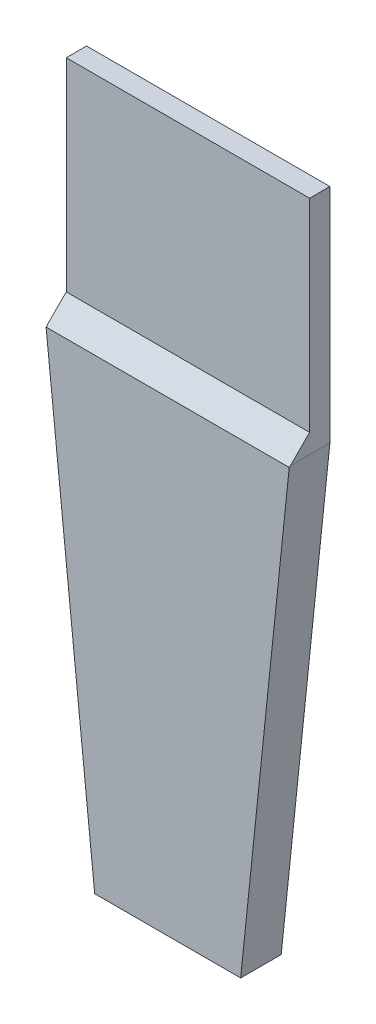
from build123d import *

# Parameters (mm, degrees)
EXTRUDE_1_DEPTH     = 1
EXTRUDE_2_DEPTH     = 6
CUT_EXTRUDE_1_DEPTH = 27.97425922


with BuildPart() as part:
    # 草图1 → 凸台-拉伸1 (new body)
    with BuildSketch(Plane.XY):
        Polygon((6, -3.227529416), (6, 7.720527774), (-6, 7.720527774), (-6, -3.227529416), (-3.598755957, -26.279472226), (3.598755957, -26.279472226), align=None)
    extrude(amount=EXTRUDE_1_DEPTH)

    # 草图2 → 凸台-拉伸2 (add, symmetric)
    with BuildSketch(Plane(origin=(0, 0, 0), x_dir=(0, 0, -1), z_dir=(1, 0, 0))):
        Polygon((-2, -26.279472226), (-1, -26.279472226), (-1, -2.279472226), (-2, -3.279472226), align=None)
    extrude(amount=EXTRUDE_2_DEPTH, both=True)

    # 草图3 → 切除-拉伸1 (cut, through all)
    with BuildSketch(Plane(origin=(0, 0, 1), x_dir=(-1, 0, 0), z_dir=(0, 0, -1))):
        Polygon((6, -26.279472226), (6, -3.227529416), (3.598755957, -26.279472226), align=None)
        Polygon((-6, -26.279472226), (-3.598755957, -26.279472226), (-6, -3.227529416), align=None)
    extrude(amount=-CUT_EXTRUDE_1_DEPTH, mode=Mode.SUBTRACT)


solid = part.part
